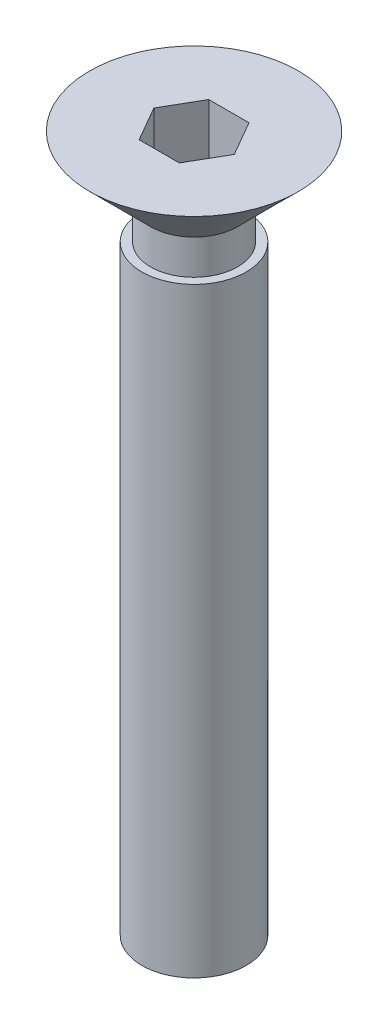
from build123d import *

# Parameters (mm, degrees)
CUT_EXTRUDE_1_DEPTH = 2


with BuildPart() as part:
    # 草图1 → 旋转1 (revolve)
    with BuildSketch(Plane.XY, mode=Mode.PRIVATE) as revolve_1_sk:
        Polygon((0, 20), (-3, 20), (-1.25, 18.25), (-1.25, 17.25), (-1.5, 17.25), (-1.5, 0), (0, 0), align=None)
    revolve(revolve_1_sk.sketch.rotate(Axis((0, 0, 0), (0, 1, 0)), 270), axis=Axis((0, 0, 0), (0, 1, 0)))

    # 草图2 → 切除-拉伸1 (cut)
    with BuildSketch(Plane(origin=(0, 20, 0), x_dir=(1, 0, 0), z_dir=(0, 1, 0))):
        Polygon((0.577350269, 1), (-0.577350269, 1), (-1.154700538, 0), (-0.577350269, -1), (0.577350269, -1), (1.154700538, 0), align=None)
    extrude(amount=-CUT_EXTRUDE_1_DEPTH, mode=Mode.SUBTRACT)


solid = part.part
